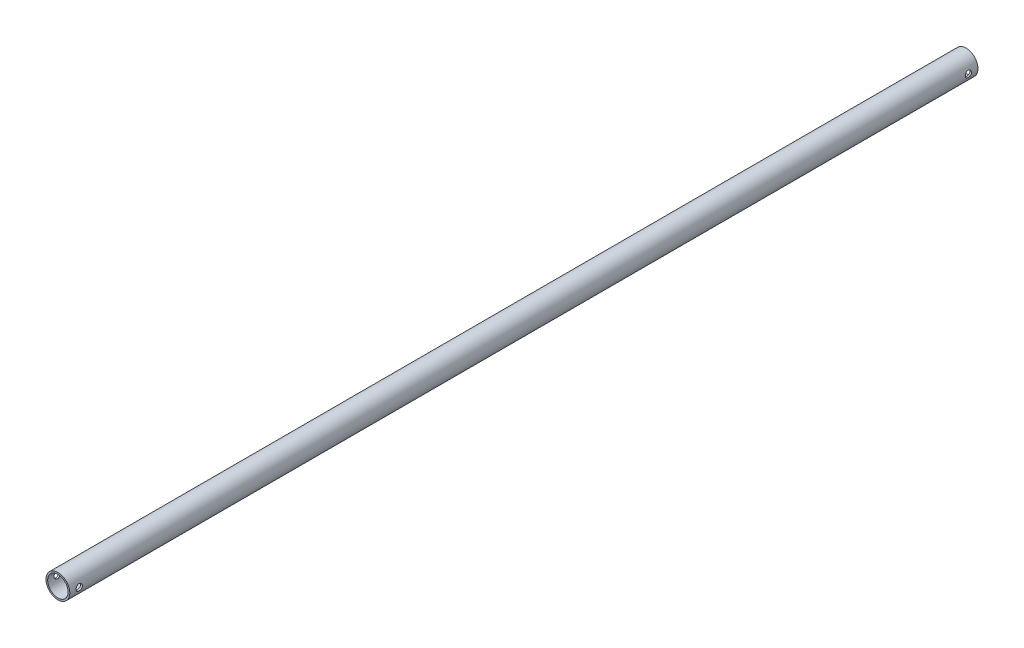
from build123d import *

# Parameters (mm, degrees)
SKETCH1_R                    = 5.9944
SKETCH1_R_2                  = 4.953
BOSS_EXTRUDE1_DEPTH          = 457.2
SKETCH8_R                    = 5.1435
CUT_EXTRUDE2_DEPTH           = 25.4
CUT_EXTRUDE3_START           = -25.4
SKETCH9_R                    = 5.1435
CUT_EXTRUDE3_DEPTH           = 25.4
F_1_8_0_125_DIAMETER_HOLE1_D = 3.175


with BuildPart() as part:
    # Sketch1 → Boss-Extrude1 (new body)
    with BuildSketch(Plane.XY):
        Circle(SKETCH1_R)
        Circle(SKETCH1_R_2, mode=Mode.SUBTRACT)
    extrude(amount=BOSS_EXTRUDE1_DEPTH)

    # Sketch8 → Cut-Extrude2 (cut)
    with BuildSketch(Plane(origin=(0, 0, 0), x_dir=(-1, 0, 0), z_dir=(0, 0, -1))):
        Circle(SKETCH8_R)
    extrude(amount=-CUT_EXTRUDE2_DEPTH, mode=Mode.SUBTRACT)

    # Sketch9 → Cut-Extrude3 (cut)
    with BuildSketch(Plane.XY.offset(457.2).offset(CUT_EXTRUDE3_START)):
        with Locations(Location((0, 0, 0), (0, 0, 180))):
            Circle(SKETCH9_R)
    extrude(amount=CUT_EXTRUDE3_DEPTH, mode=Mode.SUBTRACT)

    # 1/8 (0.125) Diameter Hole1 (through all)
    with Locations(Plane.ZY.offset(5.9944)):
        with Locations((452.4375, 0), (4.7625, 0)):
            Hole(F_1_8_0_125_DIAMETER_HOLE1_D / 2)


solid = part.part
